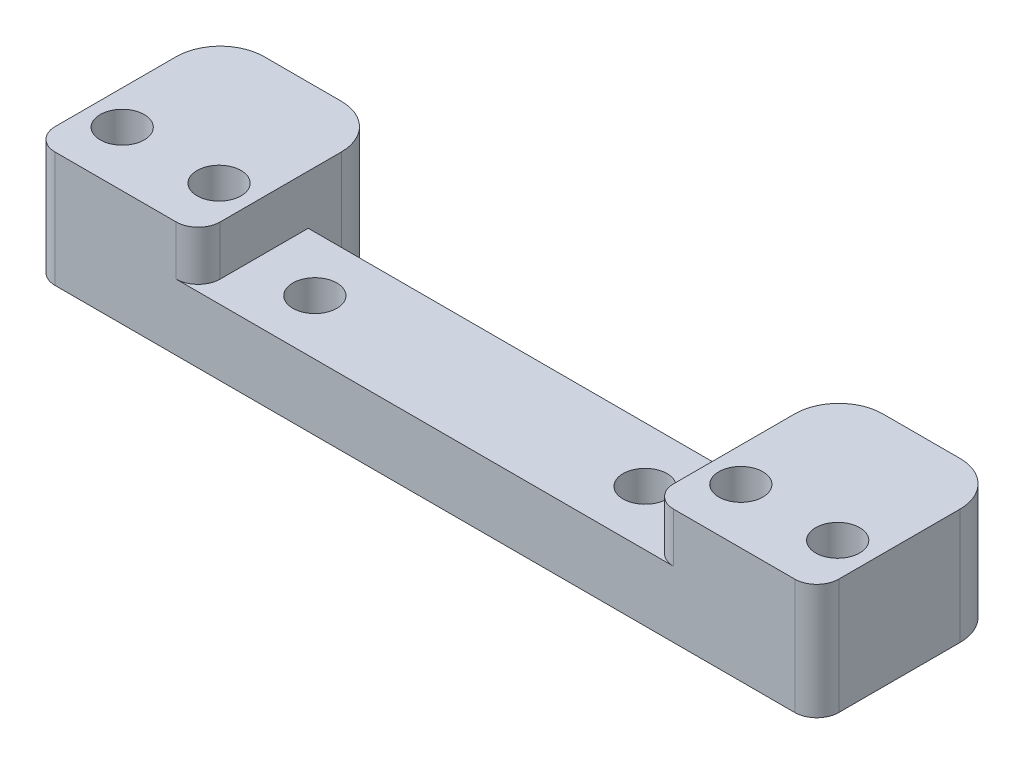
from build123d import *

# Parameters (mm, degrees)
SKETCH1_W           = 71.2
SKETCH1_H           = 10
SKETCH1_R           = 2
BOSS_EXTRUDE1_DEPTH = 6
BOSS_EXTRUDE5_START = -6
SKETCH6_W           = 15
SKETCH6_H           = 17
SKETCH6_R           = 2
BOSS_EXTRUDE5_DEPTH = 6
FILLET1_R           = 4
SKETCH7_R           = 2
BOSS_EXTRUDE6_DEPTH = 4.5
FILLET2_R           = 2


with BuildPart() as part:
    # Sketch1 → Boss-Extrude1 (new body)
    with BuildSketch(Plane(origin=(0, 0, 0), x_dir=(1, 0, 0), z_dir=(0, 1, 0))):
        Rectangle(SKETCH1_W, SKETCH1_H)
        with Locations(Location((-32.5, 0, 0), (0, 0, 270))):
            Circle(SKETCH1_R, mode=Mode.SUBTRACT)
        with Locations(Location((-23.7, 0, 0), (0, 0, 270))):
            Circle(SKETCH1_R, mode=Mode.SUBTRACT)
        with Locations(Location((23.7, 0, 0), (0, 0, 270))):
            Circle(SKETCH1_R, mode=Mode.SUBTRACT)
        with Locations(Location((32.5, 0, 0), (0, 0, 270))):
            Circle(SKETCH1_R, mode=Mode.SUBTRACT)
        with Locations(Location((-15, 0, 0), (0, 0, 270))):
            Circle(SKETCH1_R, mode=Mode.SUBTRACT)
        with Locations(Location((15, 0, 0), (0, 0, 270))):
            Circle(SKETCH1_R, mode=Mode.SUBTRACT)
    extrude(amount=BOSS_EXTRUDE1_DEPTH)

    # Sketch6 → Boss-Extrude5 (add)
    # profile 1 of 2: a face of its own
    with BuildSketch(Plane(origin=(0, 6, 0), x_dir=(1, 0, 0), z_dir=(0, 1, 0)).offset(BOSS_EXTRUDE5_START)):
        with Locations((-28.1, 3.5)):
            Rectangle(SKETCH6_W, SKETCH6_H)
        with Locations(Location((-23.7, 0, 0), (0, 0, 270))):
            Circle(SKETCH6_R, mode=Mode.SUBTRACT)
        with Locations(Location((-32.5, 0, 0), (0, 0, 270))):
            Circle(SKETCH6_R, mode=Mode.SUBTRACT)
    # profile 2 of 2: a face of its own
    with BuildSketch(Plane(origin=(0, 6, 0), x_dir=(1, 0, 0), z_dir=(0, 1, 0)).offset(BOSS_EXTRUDE5_START)):
        with Locations((28.1, 3.5)):
            Rectangle(SKETCH6_W, SKETCH6_H)
        with Locations(Location((32.5, 0, 0), (0, 0, 270))):
            Circle(SKETCH6_R, mode=Mode.SUBTRACT)
        with Locations(Location((23.7, 0, 0), (0, 0, 270))):
            Circle(SKETCH6_R, mode=Mode.SUBTRACT)
    extrude(amount=BOSS_EXTRUDE5_DEPTH)

    # Fillet1
    fillet1_edges = [part.edges().sort_by_distance(p)[0] for p in [
        (-20.6, 3, -12),
        (-35.6, 3, -12),
        (35.6, 3, -12),
        (20.6, 3, -12),
    ]]
    fillet(fillet1_edges, radius=FILLET1_R)

    # Sketch7 → Boss-Extrude6 (add)
    # profile 1 of 2: a face of its own
    with BuildSketch(Plane(origin=(0, 6, 0), x_dir=(1, 0, 0), z_dir=(0, 1, 0))):
        with BuildLine():
            Line((31.6, 12), (24.6, 12))
            ThreePointArc((24.6, 12), (21.771572875, 10.828427125), (20.6, 8))
            Line((20.6, 8), (20.6, -5))
            Line((20.6, -5), (35.6, -5))
            Line((35.6, -5), (35.6, 8))
            ThreePointArc((35.6, 8), (34.428427125, 10.828427125), (31.6, 12))
        make_face()
        with Locations(Location((32.5, 0, 0), (0, 0, 270))):
            Circle(SKETCH7_R, mode=Mode.SUBTRACT)
        with Locations(Location((23.7, 0, 0), (0, 0, 270))):
            Circle(SKETCH7_R, mode=Mode.SUBTRACT)
    # profile 2 of 2: a face of its own
    with BuildSketch(Plane(origin=(0, 6, 0), x_dir=(1, 0, 0), z_dir=(0, 1, 0))):
        with BuildLine():
            Line((-24.6, 12), (-31.6, 12))
            ThreePointArc((-31.6, 12), (-34.428427125, 10.828427125), (-35.6, 8))
            Line((-35.6, 8), (-35.6, -5))
            Line((-35.6, -5), (-20.6, -5))
            Line((-20.6, -5), (-20.6, 8))
            ThreePointArc((-20.6, 8), (-21.771572875, 10.828427125), (-24.6, 12))
        make_face()
        with Locations(Location((-23.7, 0, 0), (0, 0, 270))):
            Circle(SKETCH7_R, mode=Mode.SUBTRACT)
        with Locations(Location((-32.5, 0, 0), (0, 0, 270))):
            Circle(SKETCH7_R, mode=Mode.SUBTRACT)
    extrude(amount=BOSS_EXTRUDE6_DEPTH)

    # Fillet2
    fillet2_edges = [part.edges().sort_by_distance(p)[0] for p in [
        (20.6, 8.25, 5),
        (-20.6, 8.25, 5),
        (35.6, 5.25, 5),
        (-35.6, 5.25, 5),
    ]]
    fillet(fillet2_edges, radius=FILLET2_R)


solid = part.part
